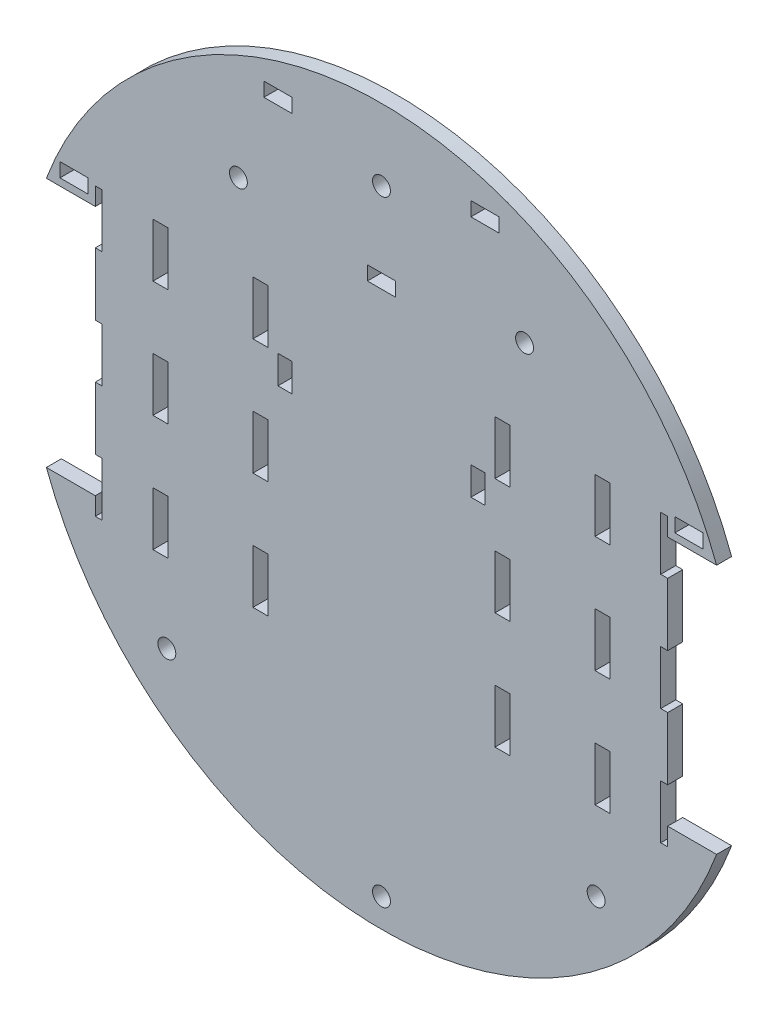
from build123d import *

# Parameters (mm, degrees)
SKETCH1_R            = 127
BODY_DEPTH           = 5.334
SKETCH7_W            = 50.8
SKETCH7_H            = 88.9
WHEELCUTS_DEPTH      = 180.684310823
SKETCH4_W            = 2.4638
SKETCH4_H            = 19.05
SKETCH4_W_2          = 5.334
MOTORMOUNTS_DEPTH    = 175.099537782
SKETCH5_R            = 3.175
CASTOR_DEPTH         = 175.099537782
SKETCH6_R            = 3.175
BOLTHOLES_DEPTH      = 175.099537782
SKETCH3_W            = 10.000000066
SKETCH3_H            = 4.999999906
SKETCH3_W_2          = 5
SKETCH3_H_2          = 10
TAPESENSCUTOUT_DEPTH = 175.099537782


with BuildPart() as part:
    # Sketch1 → Body (new body)
    with BuildSketch(Plane.XY):
        Circle(SKETCH1_R)
    extrude(amount=BODY_DEPTH)

    # Sketch7 → WheelCuts (cut, through all)
    with BuildSketch(Plane.XY.offset(5.334)):
        with Locations((-127, 0)):
            Rectangle(SKETCH7_W, SKETCH7_H)
        with Locations((127, 0)):
            Rectangle(SKETCH7_W, SKETCH7_H)
    extrude(amount=-WHEELCUTS_DEPTH, mode=Mode.SUBTRACT)

    # Sketch4 → MotorMounts (cut, through all)
    with BuildSketch(Plane.XY.offset(5.334)):
        with Locations((-100.3681, 41.275)):
            Rectangle(SKETCH4_W, SKETCH4_H)
        with Locations((-100.3681, -41.275)):
            Rectangle(SKETCH4_W, SKETCH4_H)
        with Locations((-100.3681, 0)):
            Rectangle(SKETCH4_W, SKETCH4_H)
        with Locations((-78.469199932, -41.275)):
            Rectangle(SKETCH4_W_2, SKETCH4_H)
        with Locations((-78.469199932, 41.275)):
            Rectangle(SKETCH4_W_2, SKETCH4_H)
        with Locations((-78.469199932, 0)):
            Rectangle(SKETCH4_W_2, SKETCH4_H)
        with Locations((-42.966999918, -41.275)):
            Rectangle(SKETCH4_W_2, SKETCH4_H)
        with Locations((-42.966999918, 41.275)):
            Rectangle(SKETCH4_W_2, SKETCH4_H)
        with Locations((-42.966999918, 0)):
            Rectangle(SKETCH4_W_2, SKETCH4_H)
        with Locations((42.966999918, -41.275)):
            Rectangle(SKETCH4_W_2, SKETCH4_H)
        with Locations((42.966999918, 0)):
            Rectangle(SKETCH4_W_2, SKETCH4_H)
        with Locations((42.966999918, 41.275)):
            Rectangle(SKETCH4_W_2, SKETCH4_H)
        with Locations((78.469199932, -41.275)):
            Rectangle(SKETCH4_W_2, SKETCH4_H)
        with Locations((78.469199932, 0)):
            Rectangle(SKETCH4_W_2, SKETCH4_H)
        with Locations((78.469199932, 41.275)):
            Rectangle(SKETCH4_W_2, SKETCH4_H)
        with Locations((100.3681, -41.275)):
            Rectangle(SKETCH4_W, SKETCH4_H)
        with Locations((100.3681, 0)):
            Rectangle(SKETCH4_W, SKETCH4_H)
        with Locations((100.3681, 41.275)):
            Rectangle(SKETCH4_W, SKETCH4_H)
    extrude(amount=-MOTORMOUNTS_DEPTH, mode=Mode.SUBTRACT)

    # Sketch5 → Castor (cut, through all)
    with BuildSketch(Plane.XY.offset(5.334)):
        with Locations((0, -116.84)):
            Circle(SKETCH5_R)
        with Locations((0, 101.6)):
            Circle(SKETCH5_R)
    extrude(amount=-CASTOR_DEPTH, mode=Mode.SUBTRACT)

    # Sketch6 → BoltHoles (cut, through all)
    with BuildSketch(Plane.XY.offset(5.334)):
        with Locations((-76.2, -78.74)):
            Circle(SKETCH6_R)
        with Locations((-50.8, 78.74)):
            Circle(SKETCH6_R)
        with Locations(Location((76.2, -78.74, 0), (0, 0, 180))):
            Circle(SKETCH6_R)
        with Locations(Location((50.8, 78.74, 0), (0, 0, 180))):
            Circle(SKETCH6_R)
    extrude(amount=-BOLTHOLES_DEPTH, mode=Mode.SUBTRACT)

    # Sketch3 → TapeSensCutOut (cut, through all)
    with BuildSketch(Plane.XY.offset(5.334)):
        with Locations((-36.750000033, 110.449999953)):
            Rectangle(SKETCH3_W, SKETCH3_H)
        with Locations((-109.140000033, 49.489999953)):
            Rectangle(SKETCH3_W, SKETCH3_H)
        with Locations((36.750000033, 110.449999953)):
            Rectangle(SKETCH3_W, SKETCH3_H)
        with Locations((0, 72.349999953)):
            Rectangle(SKETCH3_W, SKETCH3_H)
        with Locations((109.140000033, 49.489999953)):
            Rectangle(SKETCH3_W, SKETCH3_H)
        with Locations((34.25, 26.75)):
            Rectangle(SKETCH3_W_2, SKETCH3_H_2)
        with Locations((-34.25, 26.75)):
            Rectangle(SKETCH3_W_2, SKETCH3_H_2)
    extrude(amount=-TAPESENSCUTOUT_DEPTH, mode=Mode.SUBTRACT)


solid = part.part
